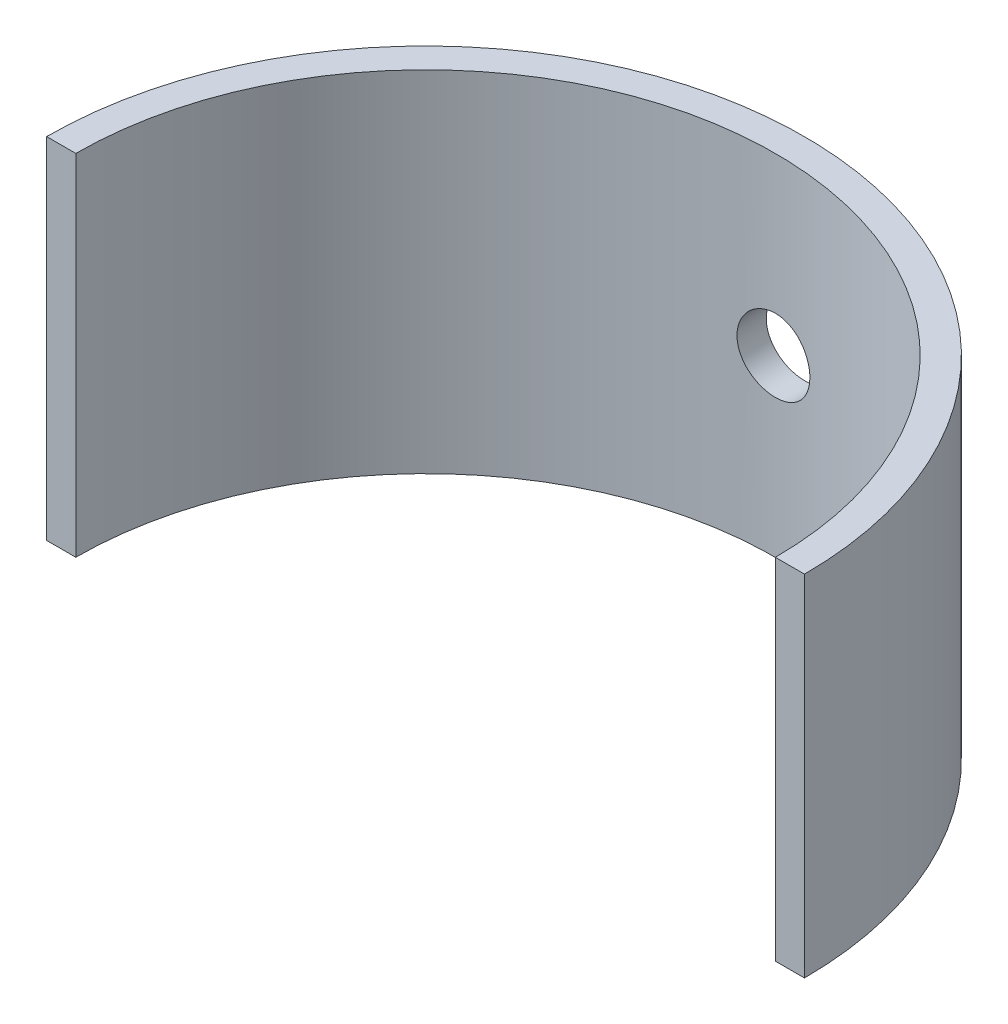
from build123d import *

# Parameters (mm, degrees)
SKETCH_1_W          = 2
SKETCH_1_H          = 24
REVOLVE_1_ANGLE     = 180
SKETCH_2_R          = 2.5
CUT_EXTRUDE_1_DEPTH = 44.9089968


with BuildPart() as part:
    # 草图1 → 旋转1 (revolve)
    with BuildSketch(Plane.XY):
        with Locations((25, 12)):
            Rectangle(SKETCH_1_W, SKETCH_1_H)
    revolve(axis=Axis((0, 25.247974217, 0), (0, 1, 0)), revolution_arc=REVOLVE_1_ANGLE)

    # 草图2 → 切除-拉伸1 (cut, through all)
    with BuildSketch(Plane.XY):
        with Locations(Location((0, 12, 0), (0, 0, 90))):
            Circle(SKETCH_2_R)
    extrude(amount=-CUT_EXTRUDE_1_DEPTH, mode=Mode.SUBTRACT)


solid = part.part
